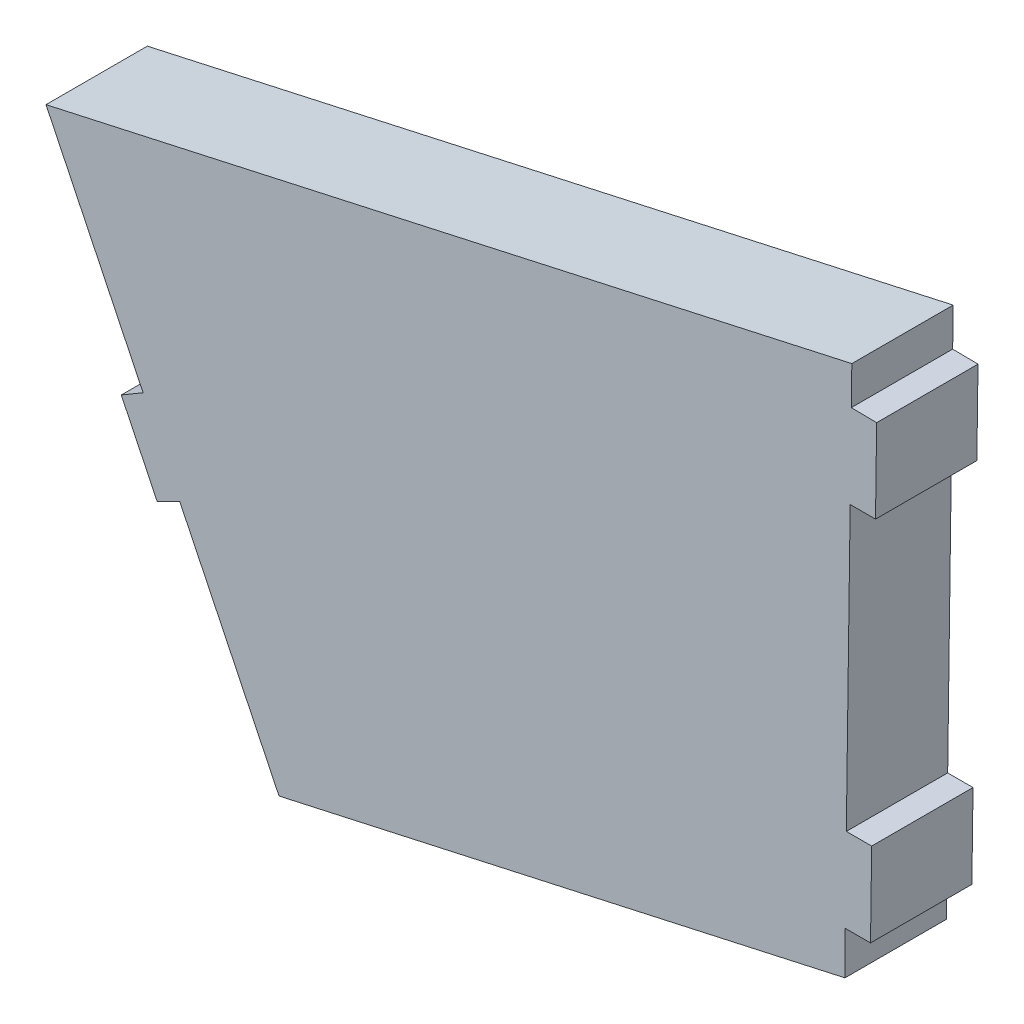
from build123d import *

# Parameters (mm, degrees)
BOSS_EXTRUDE1_DEPTH = 6


with BuildPart() as part:
    # Sketch1 → Boss-Extrude1 (new body)
    with BuildSketch(Plane.XY):
        Polygon((-4.909437377, 101.491773317), (-38.411161433, 94.064686036), (-44.28222088, 106.214770094), (-45.628146263, 105.56440357), (-47.749363271, 109.954235626), (-46.45761928, 110.716729862), (-52.205447083, 122.611787575), (-4.503400748, 133.186982483), (-4.534091643, 130.913756675), (-3.034364891, 130.893517615), (-3.101590651, 125.914212317), (-4.601590651, 125.914212317), (-4.829401001, 109.040661368), (-3.329401001, 109.040661368), (-3.39690001, 104.041117006), (-4.89690001, 104.041117006), align=None)
    extrude(amount=BOSS_EXTRUDE1_DEPTH)


solid = part.part
